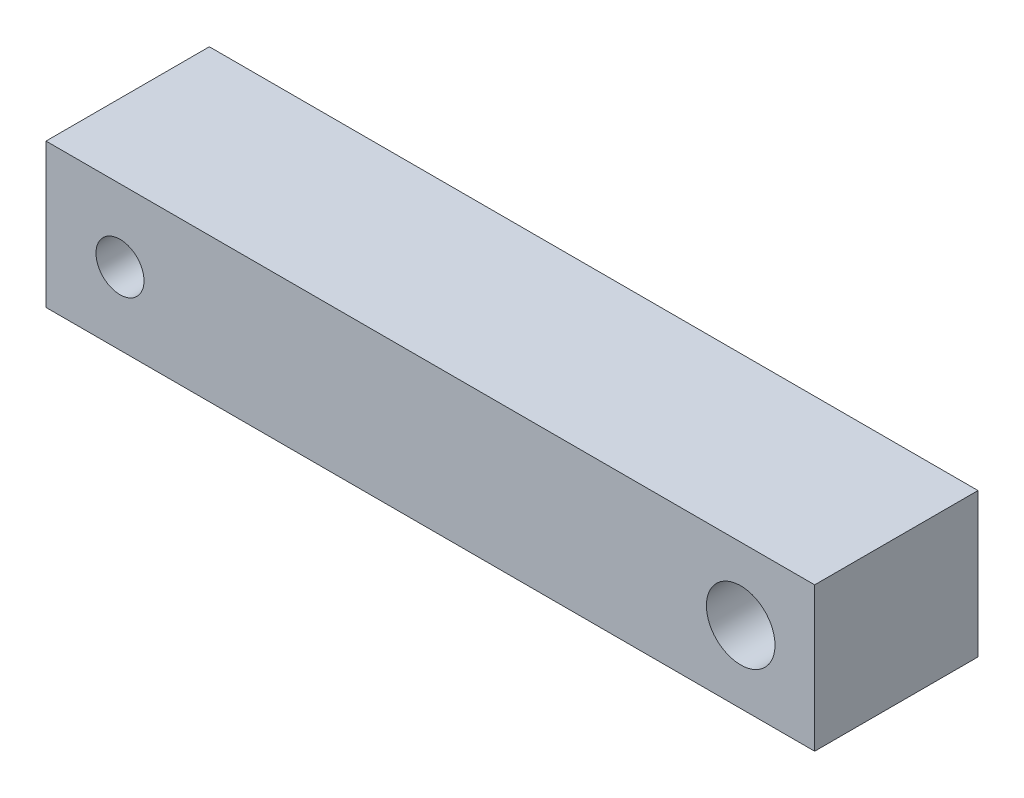
from build123d import *

# Parameters (mm, degrees)
BOSS_EXTRUDE1_START = 10
SKETCH1_W           = 80
SKETCH1_H           = 15
SKETCH1_R           = 3.57
SKETCH1_R_2         = 2.5
BOSS_EXTRUDE1_DEPTH = 17


with BuildPart() as part:
    # Sketch1 → Boss-Extrude1 (new body)
    with BuildSketch(Plane.XY.offset(BOSS_EXTRUDE1_START)):
        with Locations((0, 33.230865744)):
            Rectangle(SKETCH1_W, SKETCH1_H)
        with Locations((32.3, 33.230865744)):
            Circle(SKETCH1_R, mode=Mode.SUBTRACT)
        with Locations((-32.3, 33.230865744)):
            Circle(SKETCH1_R_2, mode=Mode.SUBTRACT)
    extrude(amount=BOSS_EXTRUDE1_DEPTH)


solid = part.part
